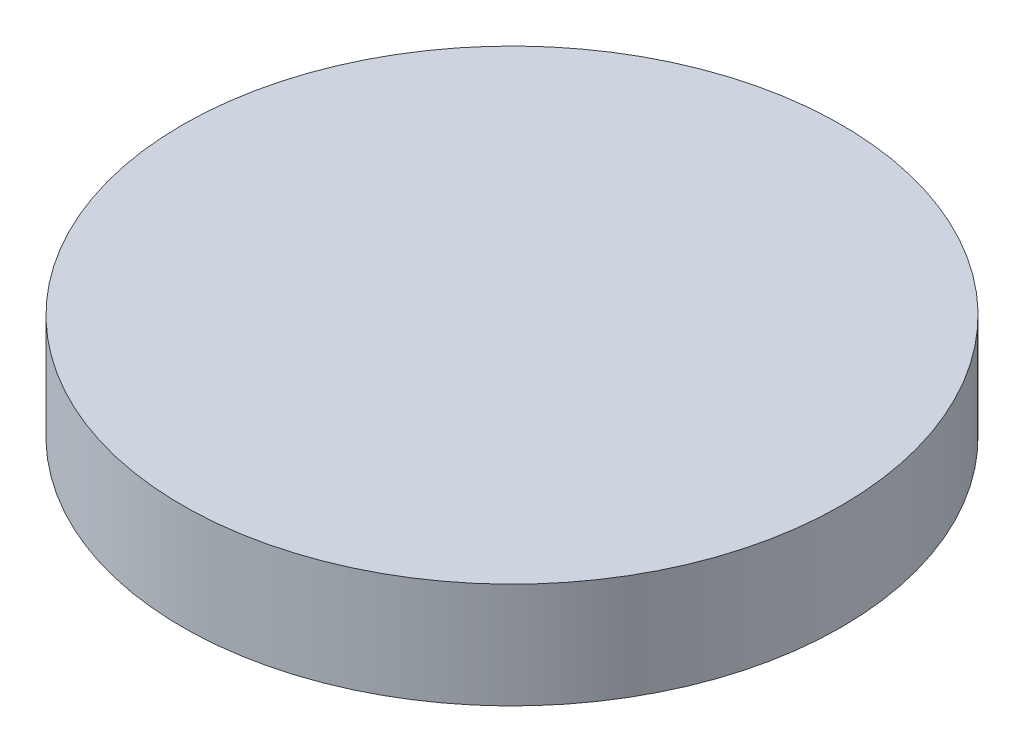
from build123d import *

# Parameters (mm, degrees)
SKETCH1_W = 12.5
SKETCH1_H = 4


with BuildPart() as part:
    # Sketch1 → Revolve1 (revolve)
    with BuildSketch(Plane.XY):
        with Locations((-6.25, -2)):
            Rectangle(SKETCH1_W, SKETCH1_H)
    revolve(axis=Axis((0, 0, 0), (0, -1, 0)))


solid = part.part
